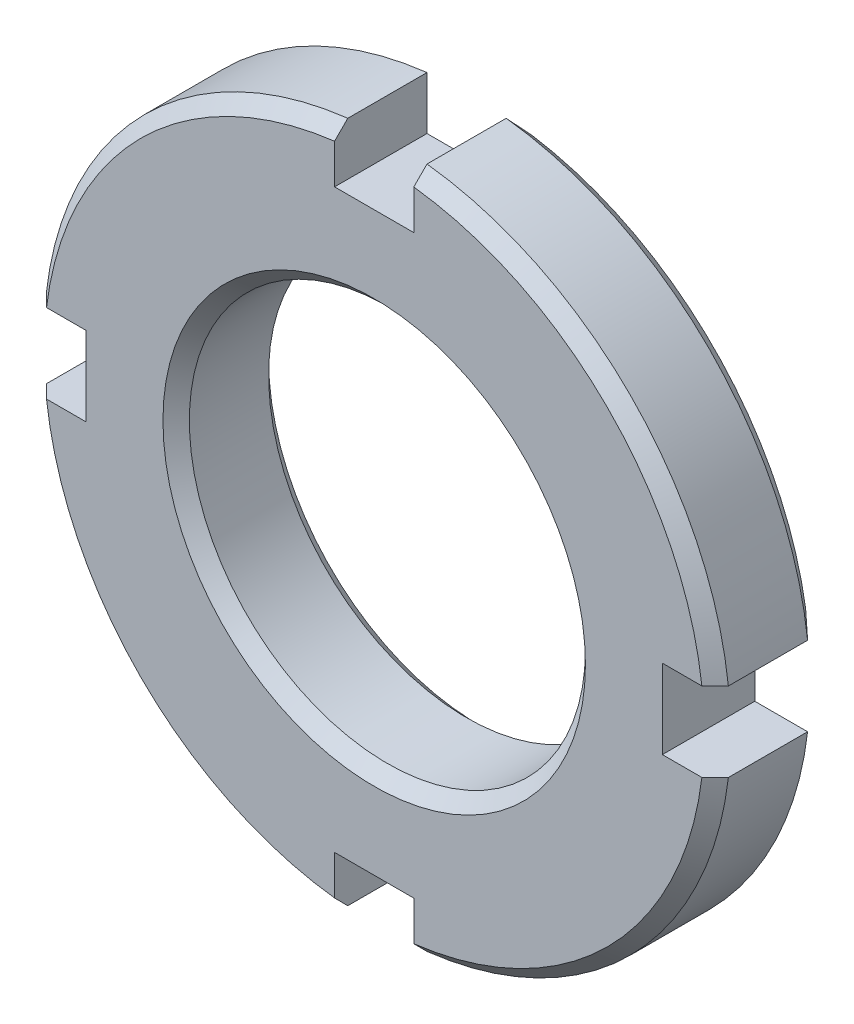
from build123d import *

# Parameters (mm, degrees)
SKETCH_1_R      = 7.5
EXTRUDE_1_DEPTH = 4
CHAMFER_1_SIZE  = 0.5


with BuildPart() as part:
    # Эскиз1 → Бобышка-Вытянуть1 (new body)
    with BuildSketch(Plane.XY):
        with BuildLine():
            Line((1.5, 12.91317157), (1.5, 10.91317157))
            Line((1.5, 10.91317157), (-1.5, 10.91317157))
            Line((-1.5, 10.91317157), (-1.5, 12.91317157))
            ThreePointArc((-1.5, 12.91317157), (-9.192388155, 9.192388155), (-12.91317157, 1.5))
            Line((-12.91317157, 1.5), (-10.91317157, 1.5))
            Line((-10.91317157, 1.5), (-10.91317157, -1.5))
            Line((-10.91317157, -1.5), (-12.91317157, -1.5))
            ThreePointArc((-12.91317157, -1.5), (-9.192388155, -9.192388155), (-1.5, -12.91317157))
            Line((-1.5, -12.91317157), (-1.5, -10.91317157))
            Line((-1.5, -10.91317157), (1.5, -10.91317157))
            Line((1.5, -10.91317157), (1.5, -12.91317157))
            ThreePointArc((1.5, -12.91317157), (9.192388155, -9.192388155), (12.91317157, -1.5))
            Line((12.91317157, -1.5), (10.91317157, -1.5))
            Line((10.91317157, -1.5), (10.91317157, 1.5))
            Line((10.91317157, 1.5), (12.91317157, 1.5))
            ThreePointArc((12.91317157, 1.5), (9.192388155, 9.192388155), (1.5, 12.91317157))
        make_face()
        Circle(SKETCH_1_R, mode=Mode.SUBTRACT)
    extrude(amount=EXTRUDE_1_DEPTH)

    # Фаска1
    chamfer_1_edges = [part.edges().sort_by_distance(p)[0] for p in [
        (-1.5, 11.91317157, 0),
        (0, 10.91317157, 0),
        (1.5, 11.91317157, 0),
        (9.192388155, 9.192388155, 0),
        (11.91317157, 1.5, 0),
        (-9.192388155, -9.192388155, 4),
        (10.91317157, 0, 0),
        (11.91317157, -1.5, 0),
        (9.192388155, -9.192388155, 0),
        (1.5, -11.91317157, 0),
        (0, -10.91317157, 0),
        (-1.5, -11.91317157, 0),
        (-9.192388155, -9.192388155, 0),
        (-11.91317157, -1.5, 0),
        (-10.91317157, 0, 0),
        (-11.91317157, 1.5, 0),
        (-9.192388155, 9.192388155, 0),
        (9.192388155, -9.192388155, 4),
        (-7.5, 0, 0),
        (-7.5, 0, 4),
        (-9.192388155, 9.192388155, 4),
        (9.192388155, 9.192388155, 4),
    ]]
    chamfer(chamfer_1_edges, length=CHAMFER_1_SIZE)


solid = part.part
